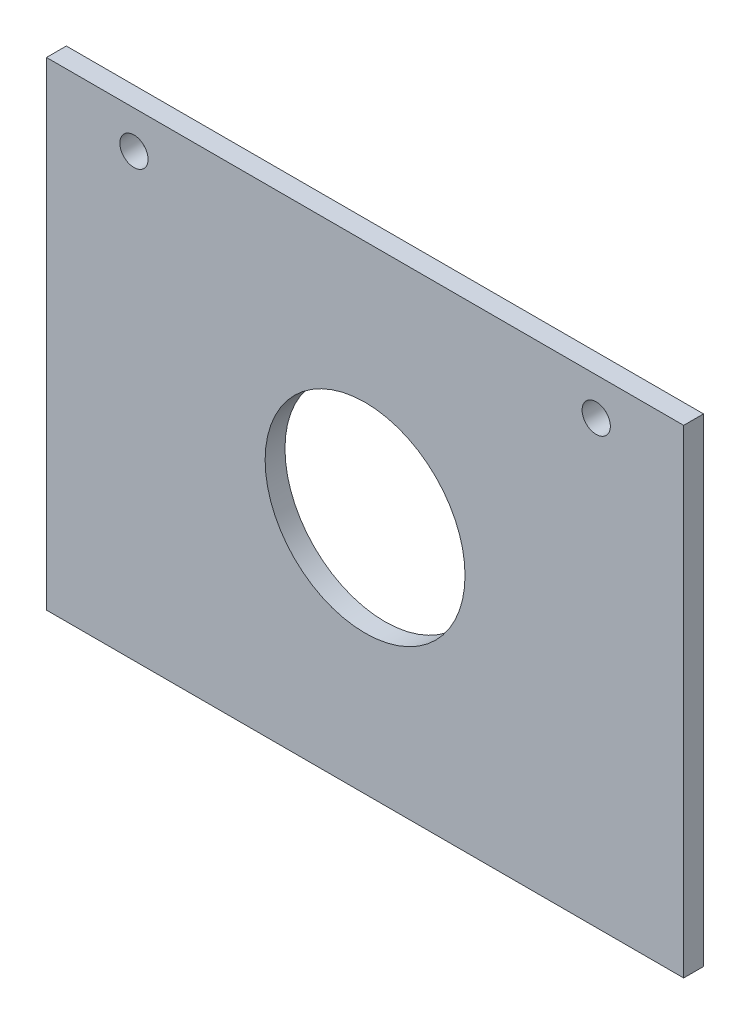
from build123d import *

# Parameters (mm, degrees)
SKETCH1_W           = 51
SKETCH1_H           = 38.31
SKETCH1_R           = 8
BOSS_EXTRUDE1_DEPTH = 1.5875
SKETCH2_R           = 1.1303
CUT_EXTRUDE1_DEPTH  = 1.5875


with BuildPart() as part:
    # Sketch1 → Boss-Extrude1 (new body)
    with BuildSketch(Plane.XY):
        with Locations((25.5, 19.155)):
            Rectangle(SKETCH1_W, SKETCH1_H)
        with Locations((25.5, 19.155)):
            Circle(SKETCH1_R, mode=Mode.SUBTRACT)
    extrude(amount=BOSS_EXTRUDE1_DEPTH)

    # Sketch2 → Cut-Extrude1 (cut)
    with BuildSketch(Plane.XY.offset(1.5875)):
        with Locations((44, 35.31)):
            Circle(SKETCH2_R)
        with Locations((7, 35.31)):
            Circle(SKETCH2_R)
    extrude(amount=-CUT_EXTRUDE1_DEPTH, mode=Mode.SUBTRACT)


solid = part.part
